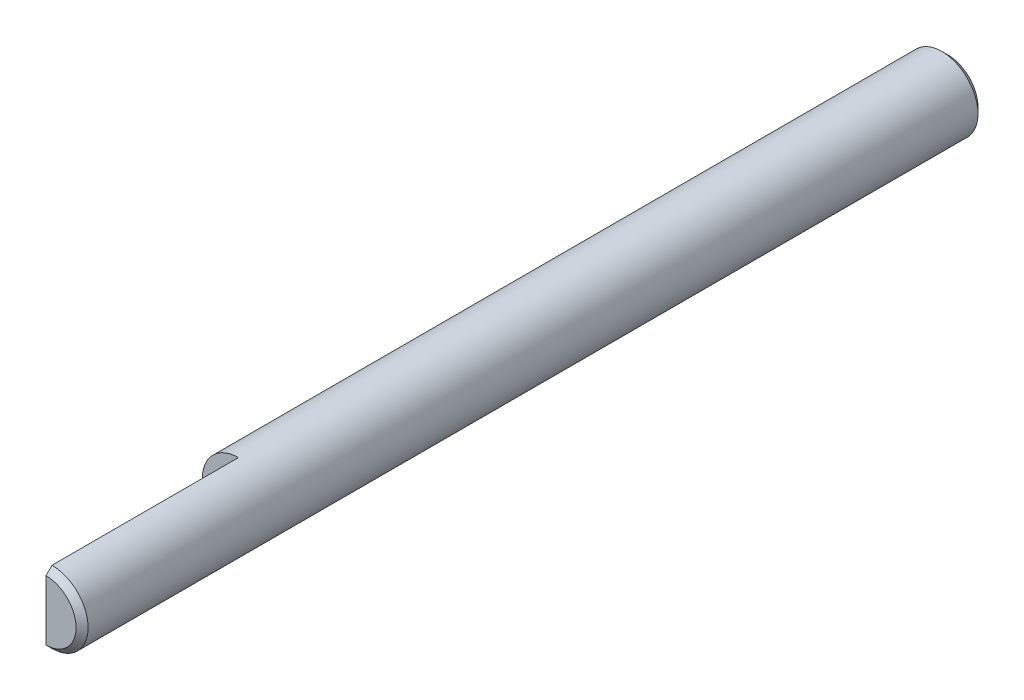
from build123d import *

# Parameters (mm, degrees)
SKETCH1_R           = 3
BOSS_EXTRUDE1_DEPTH = 75
CHAMFER1_SIZE       = 0.5
CUT_EXTRUDE2_START  = -16
CUT_EXTRUDE2_DEPTH  = 16


with BuildPart() as part:
    # Sketch1 → Boss-Extrude1 (new body)
    with BuildSketch(Plane.XY):
        Circle(SKETCH1_R)
    extrude(amount=BOSS_EXTRUDE1_DEPTH)

    # Chamfer1
    chamfer1_edges = [part.edges().sort_by_distance(p)[0] for p in [
        (-3, 0, 0),
        (-3, 0, 75),
    ]]
    chamfer(chamfer1_edges, length=CHAMFER1_SIZE)

    # Sketch2 → Cut-Extrude2 (cut)
    with BuildSketch(Plane.XY.offset(75).offset(CUT_EXTRUDE2_START)):
        with BuildLine():
            Line((0, -3), (0, 3))
            ThreePointArc((0, 3), (-3, 0), (0, -3))
        make_face()
    extrude(amount=CUT_EXTRUDE2_DEPTH, mode=Mode.SUBTRACT)


solid = part.part
